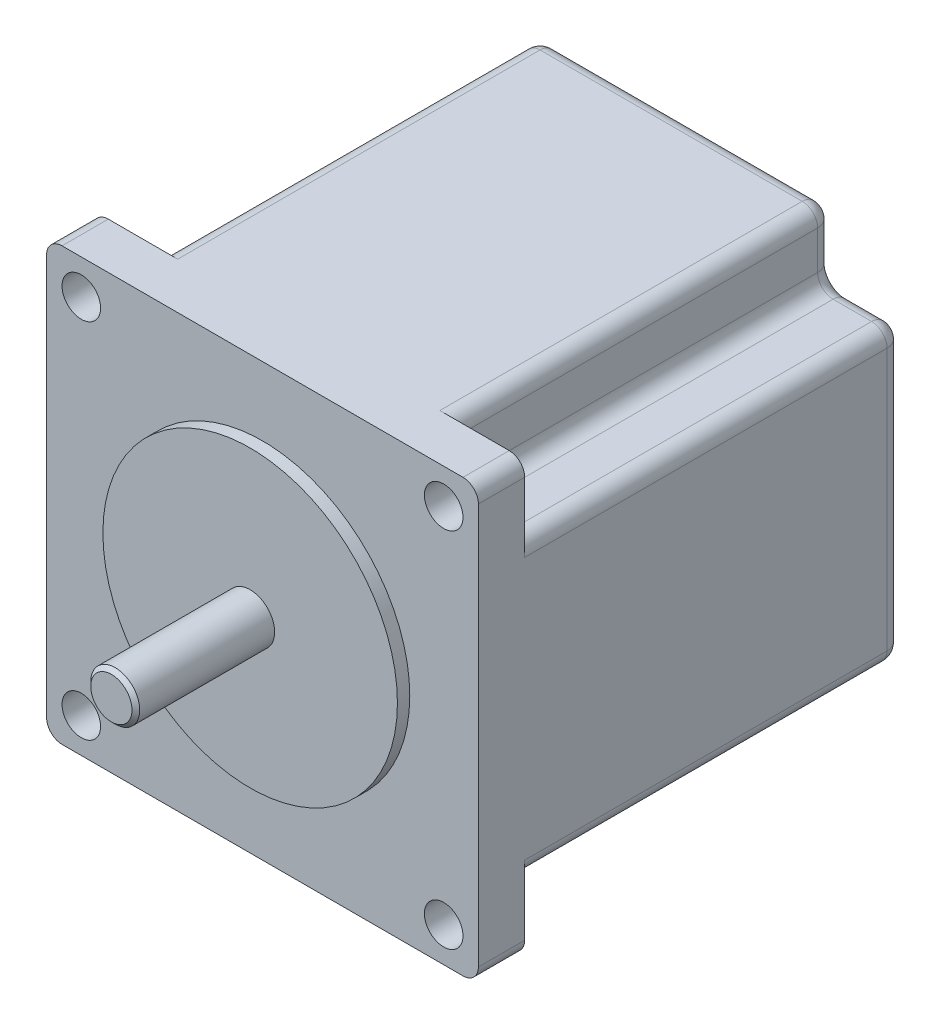
from build123d import *

# Parameters (mm, degrees)
SKETCH_1_W          = 56
SKETCH_1_H          = 56
EXTRUDE_1_DEPTH     = 55
SKETCH_2_W          = 9
SKETCH_2_H          = 9
CUT_EXTRUDE_1_DEPTH = 49
FILLET_1_R          = 2
SKETCH_3_R          = 19.1
EXTRUDE_2_DEPTH     = 1.6
SKETCH_4_R          = 3.175
EXTRUDE_3_DEPTH     = 18
SKETCH_5_R          = 2.5
CUT_EXTRUDE_2_DEPTH = 18
CHAMFER_1_SIZE      = 0.5


with BuildPart() as part:
    # Эскиз1 → Вытянуть1 (new body)
    with BuildSketch(Plane.XY):
        with Locations((28, 28)):
            Rectangle(SKETCH_1_W, SKETCH_1_H)
    extrude(amount=EXTRUDE_1_DEPTH)

    # Эскиз2 → Вырез-Вытянуть1 (cut)
    with BuildSketch(Plane(origin=(0, 0, 0), x_dir=(-1, 0, 0), z_dir=(0, 0, -1))):
        with Locations((-51.5, 51.5)):
            Rectangle(SKETCH_2_W, SKETCH_2_H)
        with Locations((-4.5, 51.5)):
            Rectangle(SKETCH_2_W, SKETCH_2_H)
        with Locations((-4.5, 4.5)):
            Rectangle(SKETCH_2_W, SKETCH_2_H)
        with Locations((-51.5, 4.5)):
            Rectangle(SKETCH_2_W, SKETCH_2_H)
    extrude(amount=-CUT_EXTRUDE_1_DEPTH, mode=Mode.SUBTRACT)

    # Скругление1
    fillet_1_edges = [part.edges().sort_by_distance(p)[0] for p in [
        (28, 56, 0),
        (56, 47, 24.5),
        (47, 56, 24.5),
        (47, 47, 24.5),
        (51.5, 47, 0),
        (47, 51.5, 0),
        (0, 28, 0),
        (9, 56, 24.5),
        (0, 47, 24.5),
        (9, 47, 24.5),
        (9, 51.5, 0),
        (4.5, 47, 0),
        (28, 0, 0),
        (0, 9, 24.5),
        (9, 0, 24.5),
        (9, 9, 24.5),
        (4.5, 9, 0),
        (9, 4.5, 0),
        (56, 28, 0),
        (47, 0, 24.5),
        (56, 9, 24.5),
        (47, 9, 24.5),
        (47, 4.5, 0),
        (51.5, 9, 0),
        (0, 56, 52),
        (56, 56, 52),
        (56, 0, 52),
        (0, 0, 52),
    ]]
    fillet(fillet_1_edges, radius=FILLET_1_R)

    # Эскиз3 → Вытянуть2 (add)
    with BuildSketch(Plane.XY.offset(55)):
        with Locations(Location((28, 28, 0), (0, 0, 180))):
            Circle(SKETCH_3_R)
    extrude(amount=EXTRUDE_2_DEPTH)

    # Эскиз4 → Вытянуть3 (add)
    with BuildSketch(Plane.XY.offset(56.6)):
        with Locations((28, 28)):
            Circle(SKETCH_4_R)
    extrude(amount=EXTRUDE_3_DEPTH)

    # Эскиз5 → Вырез-Вытянуть2 (cut)
    with BuildSketch(Plane.XY.offset(55)):
        with Locations((4.5, 51.5)):
            Circle(SKETCH_5_R)
        with Locations((51.5, 51.5)):
            Circle(SKETCH_5_R)
        with Locations((4.5, 4.5)):
            Circle(SKETCH_5_R)
        with Locations((51.5, 4.5)):
            Circle(SKETCH_5_R)
    extrude(amount=-CUT_EXTRUDE_2_DEPTH, mode=Mode.SUBTRACT)

    # Фаска1
    chamfer_1_edges = [part.edges().sort_by_distance(p)[0] for p in [
        (24.825, 28, 74.6),
    ]]
    chamfer(chamfer_1_edges, length=CHAMFER_1_SIZE)


solid = part.part
